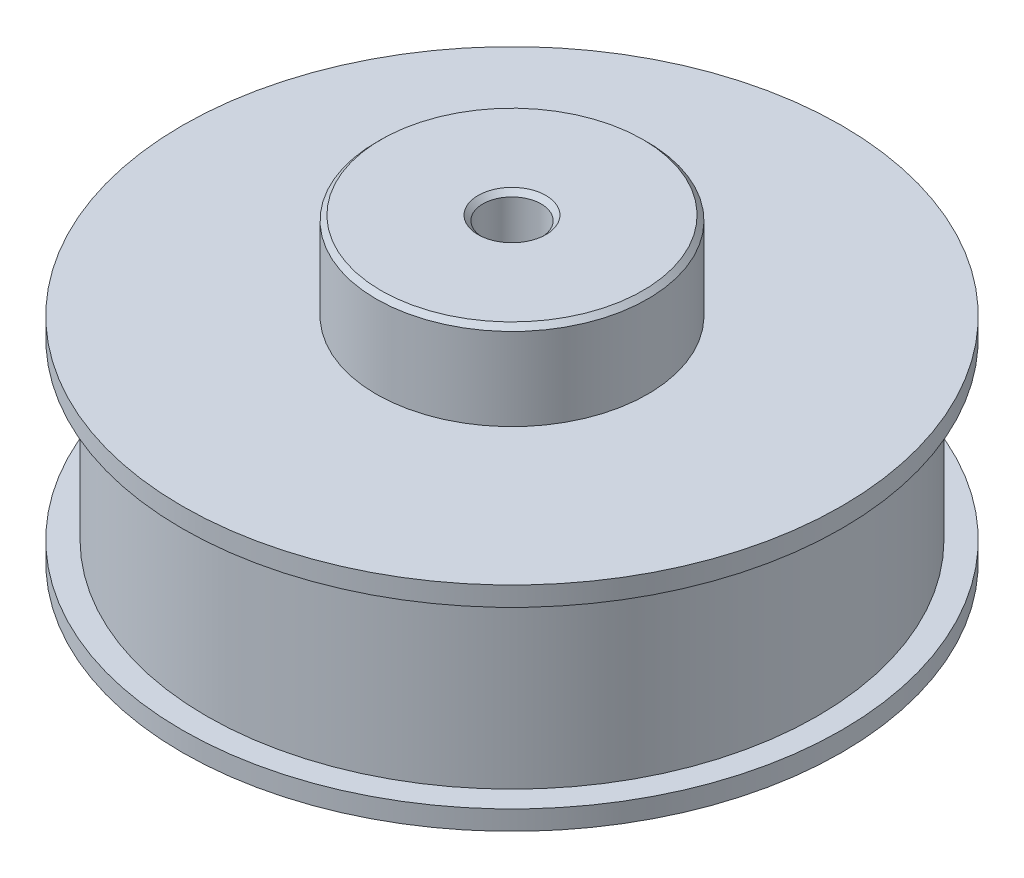
from build123d import *

# Parameters (mm, degrees)
SKETCH1_R           = 34
BOSS_EXTRUDE1_DEPTH = 22
CUT_EXTRUDE1_START  = -20
SKETCH2_R           = 34
SKETCH2_R_2         = 31.5
CUT_EXTRUDE1_DEPTH  = 18
SKETCH3_R           = 14
BOSS_EXTRUDE2_DEPTH = 9
CHAMFER1_SIZE       = 0.5
SKETCH4_R           = 3
CUT_EXTRUDE2_DEPTH  = 31
CHAMFER2_SIZE       = 0.5


with BuildPart() as part:
    # Sketch1 → Boss-Extrude1 (new body)
    with BuildSketch(Plane(origin=(0, 0, 0), x_dir=(1, 0, 0), z_dir=(0, 1, 0))):
        with Locations(Location((0, 0, 0), (0, 0, 270))):
            Circle(SKETCH1_R)
    extrude(amount=BOSS_EXTRUDE1_DEPTH)

    # Sketch2 → Cut-Extrude1 (cut)
    with BuildSketch(Plane(origin=(0, 22, 0), x_dir=(1, 0, 0), z_dir=(0, 1, 0)).offset(CUT_EXTRUDE1_START)):
        with Locations(Location((0, 0, 0), (0, 0, 270))):
            Circle(SKETCH2_R)
        with Locations(Location((0, 0, 0), (0, 0, 270))):
            Circle(SKETCH2_R_2, mode=Mode.SUBTRACT)
    extrude(amount=CUT_EXTRUDE1_DEPTH, mode=Mode.SUBTRACT)

    # Sketch3 → Boss-Extrude2 (add)
    with BuildSketch(Plane(origin=(0, 22, 0), x_dir=(1, 0, 0), z_dir=(0, 1, 0))):
        with Locations(Location((0, 0, 0), (0, 0, 270))):
            Circle(SKETCH3_R)
    extrude(amount=BOSS_EXTRUDE2_DEPTH)

    # Chamfer1
    chamfer1_edges = [part.edges().sort_by_distance(p)[0] for p in [
        (0, 31, -14),
    ]]
    chamfer(chamfer1_edges, length=CHAMFER1_SIZE)

    # Sketch4 → Cut-Extrude2 (cut)
    with BuildSketch(Plane(origin=(0, 31, 0), x_dir=(1, 0, 0), z_dir=(0, 1, 0))):
        with Locations(Location((0, 0, 0), (0, 0, 270))):
            Circle(SKETCH4_R)
    extrude(amount=-CUT_EXTRUDE2_DEPTH, mode=Mode.SUBTRACT)

    # Chamfer2
    chamfer2_edges = [part.edges().sort_by_distance(p)[0] for p in [
        (0, 31, -3),
    ]]
    chamfer(chamfer2_edges, length=CHAMFER2_SIZE)


solid = part.part
